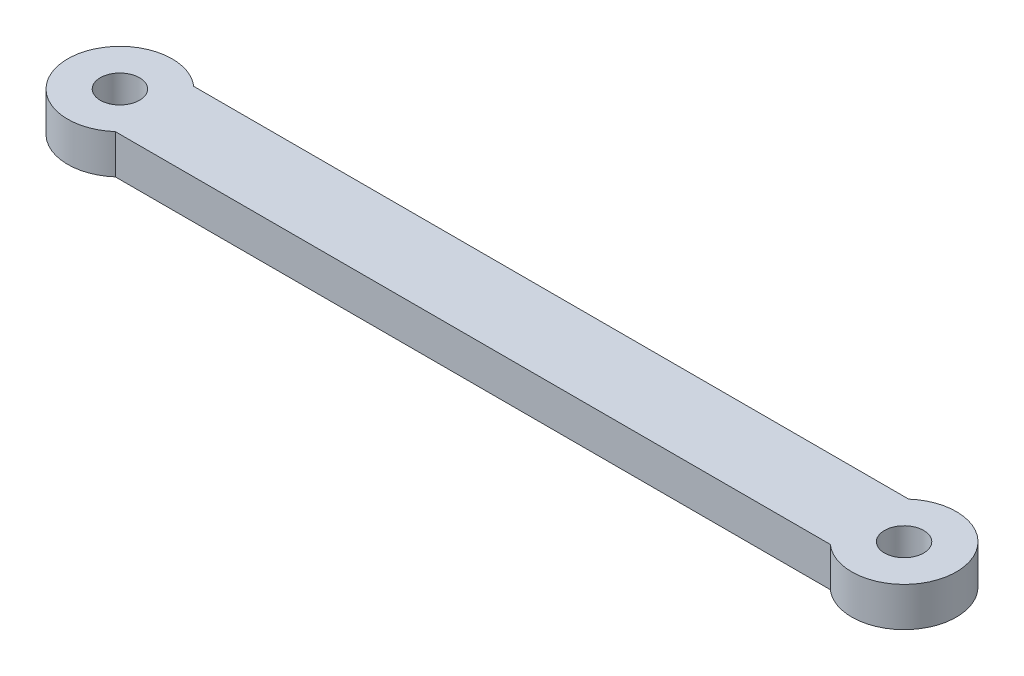
from build123d import *

# Parameters (mm, degrees)
CROQUIS1_R              = 1.5
SALIENTE_EXTRUIR1_DEPTH = 3


with BuildPart() as part:
    # Croquis1 → Saliente-Extruir1 (new body)
    with BuildSketch(Plane(origin=(0, 0, 0), x_dir=(1, 0, 0), z_dir=(0, 1, 0))):
        with BuildLine():
            Line((-27.354248689, 3), (27.354248689, 3))
            ThreePointArc((27.354248689, 3), (34, 0), (27.354248689, -3))
            Line((27.354248689, -3), (-27.354248689, -3))
            ThreePointArc((-27.354248689, -3), (-34, 0), (-27.354248689, 3))
        make_face()
        with Locations(Location((-30, 0, 0), (0, 0, 270))):
            Circle(CROQUIS1_R, mode=Mode.SUBTRACT)
        with Locations(Location((30, 0, 0), (0, 0, 90))):
            Circle(CROQUIS1_R, mode=Mode.SUBTRACT)
    extrude(amount=SALIENTE_EXTRUIR1_DEPTH)


solid = part.part
